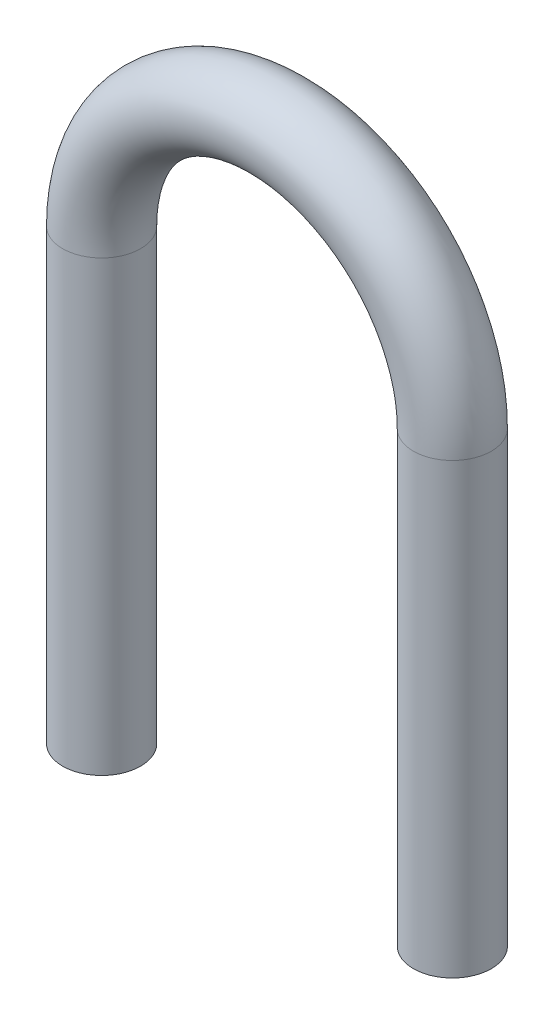
from build123d import *

# Parameters (mm, degrees)
SKETCH2_R = 3


with BuildPart() as part:
    # Sweep1: sweep along a path in Sketch1
    with BuildLine(Plane.XY) as sweep1_path:
        Line((-13.5, -48), (-13.5, -13.5))
        ThreePointArc((-13.5, -13.5), (0, 0), (13.5, -13.5))
        Line((13.5, -13.5), (13.5, -48))
    # Sketch2 → Sweep1 (sweep)
    with BuildSketch(Plane(origin=(0, -48, 0), x_dir=(1, 0, 0), z_dir=(0, 1, 0))):
        with Locations((-13.5, 0)):
            Circle(SKETCH2_R)
    sweep(path=sweep1_path.line)


solid = part.part
